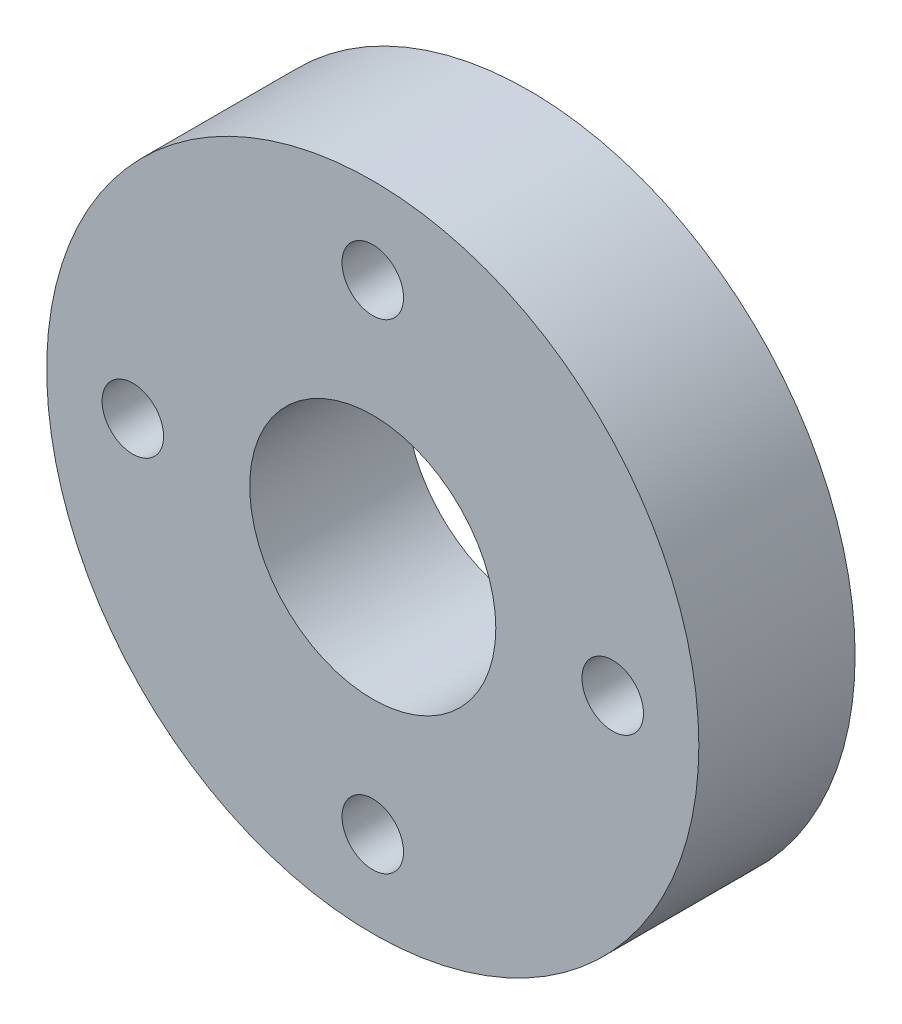
from build123d import *

# Parameters (mm, degrees)
SKETCH3_R           = 13.25
BOSS_EXTRUDE1_DEPTH = 6.35
SKETCH4_R           = 5
SKETCH4_R_2         = 1.25
CUT_EXTRUDE1_DEPTH  = 6.35


with BuildPart() as part:
    # Sketch3 → Boss-Extrude1 (new body)
    with BuildSketch(Plane.XY):
        Circle(SKETCH3_R)
    extrude(amount=BOSS_EXTRUDE1_DEPTH)

    # Sketch4 → Cut-Extrude1 (cut)
    with BuildSketch(Plane.XY.offset(6.35)):
        Circle(SKETCH4_R)
        with Locations((0, 9.75)):
            Circle(SKETCH4_R_2)
        with Locations((9.75, 0)):
            Circle(SKETCH4_R_2)
        with Locations((0, -9.75)):
            Circle(SKETCH4_R_2)
        with Locations((-9.75, 0)):
            Circle(SKETCH4_R_2)
    extrude(amount=-CUT_EXTRUDE1_DEPTH, mode=Mode.SUBTRACT)


solid = part.part
